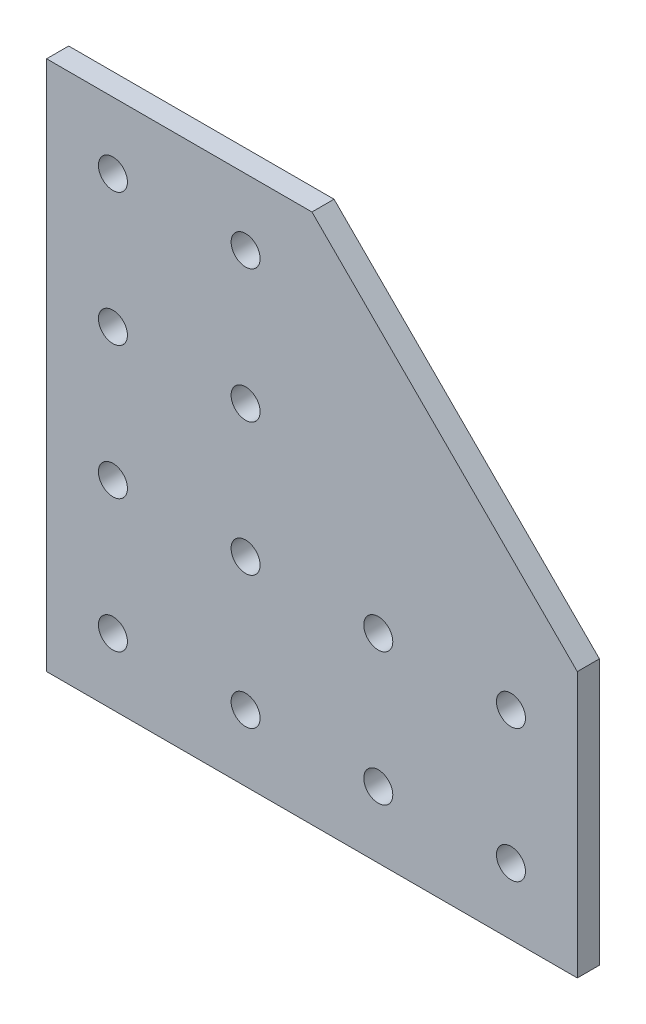
from build123d import *

# Parameters (mm, degrees)
SKETCH1_R           = 4.1656
BOSS_EXTRUDE1_DEPTH = 3.175


with BuildPart() as part:
    # Sketch1 → Boss-Extrude1 (new, symmetric)
    with BuildSketch(Plane.XY):
        Polygon((0, 0), (0, 152.4), (76.2, 152.4), (152.4, 76.2), (152.4, 0), align=None)
        with Locations((19.05, 19.05)):
            Circle(SKETCH1_R, mode=Mode.SUBTRACT)
        with Locations((57.15, 19.05)):
            Circle(SKETCH1_R, mode=Mode.SUBTRACT)
        with Locations((95.25, 19.05)):
            Circle(SKETCH1_R, mode=Mode.SUBTRACT)
        with Locations((19.05, 57.15)):
            Circle(SKETCH1_R, mode=Mode.SUBTRACT)
        with Locations((19.05, 95.25)):
            Circle(SKETCH1_R, mode=Mode.SUBTRACT)
        with Locations((133.35, 19.05)):
            Circle(SKETCH1_R, mode=Mode.SUBTRACT)
        with Locations((133.35, 57.15)):
            Circle(SKETCH1_R, mode=Mode.SUBTRACT)
        with Locations((95.25, 57.15)):
            Circle(SKETCH1_R, mode=Mode.SUBTRACT)
        with Locations((57.15, 57.15)):
            Circle(SKETCH1_R, mode=Mode.SUBTRACT)
        with Locations((19.05, 133.35)):
            Circle(SKETCH1_R, mode=Mode.SUBTRACT)
        with Locations((57.15, 133.35)):
            Circle(SKETCH1_R, mode=Mode.SUBTRACT)
        with Locations((57.15, 95.25)):
            Circle(SKETCH1_R, mode=Mode.SUBTRACT)
    extrude(amount=BOSS_EXTRUDE1_DEPTH, both=True)


solid = part.part
